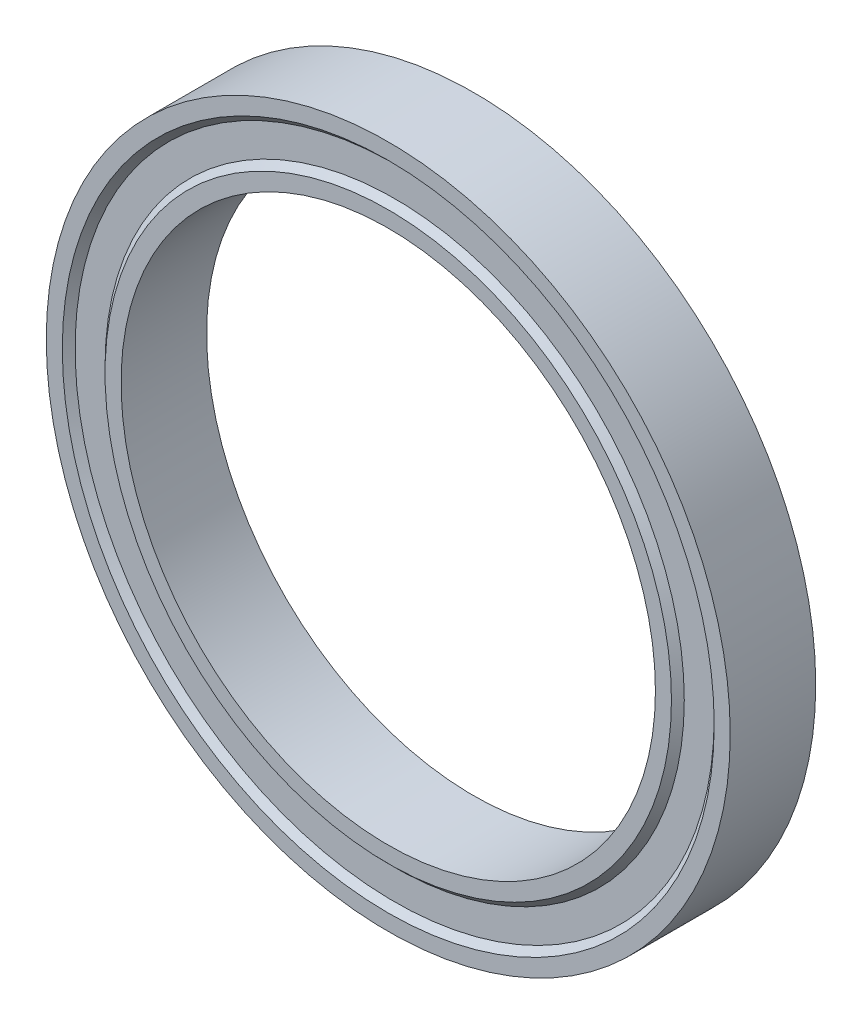
from build123d import *


with BuildPart() as part:
    # Sketch1 → Revolve1 (revolve)
    with BuildSketch(Plane(origin=(0, 0, 0), x_dir=(1, 0, 0), z_dir=(0, 1, 0))):
        Polygon((12.5, -2), (12.5, 2), (13.25, 2), (13.55, 1.7), (14.95, 1.7), (15.25, 2), (16, 2), (16, -2), (15.25, -2), (14.95, -1.7), (13.55, -1.7), (13.25, -2), align=None)
    revolve(axis=Axis((0, 0, 0), (0, 0, -1)))


solid = part.part
